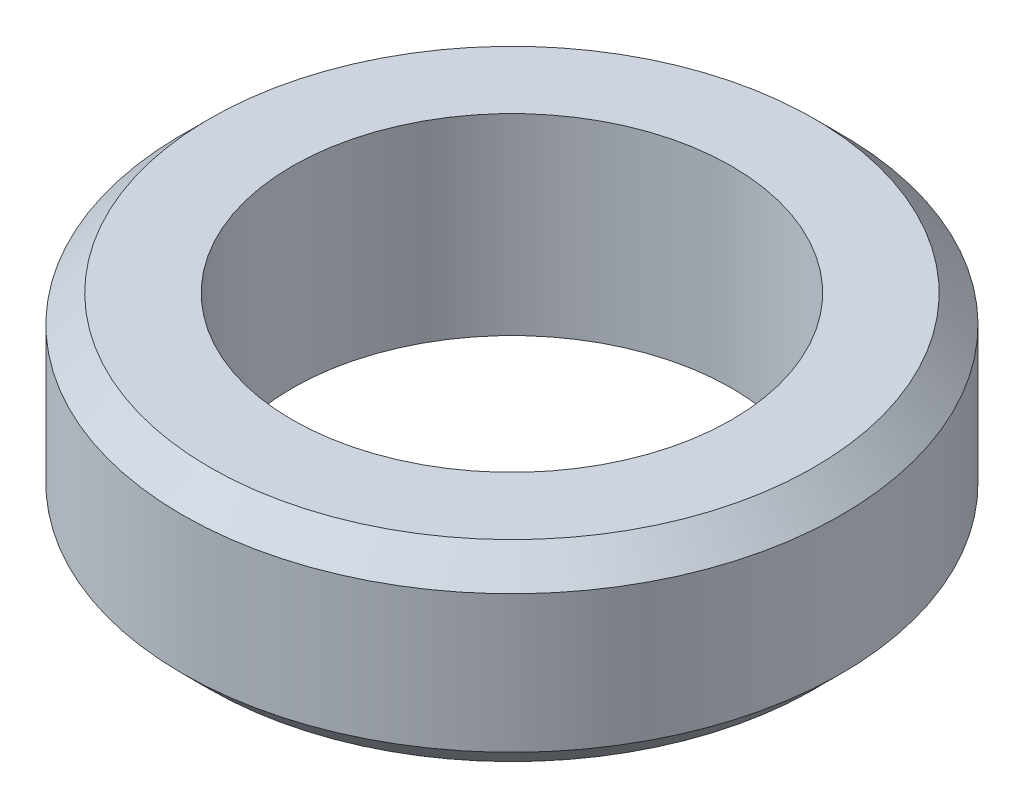
from build123d import *

# Parameters (mm, degrees)
SKETCH1_R           = 6
SKETCH1_R_2         = 4
BOSS_EXTRUDE1_DEPTH = 3.5
CHAMFER1_SIZE       = 0.5


with BuildPart() as part:
    # Sketch1 → Boss-Extrude1 (new body)
    with BuildSketch(Plane(origin=(0, 0, 0), x_dir=(1, 0, 0), z_dir=(0, 1, 0))):
        with Locations(Location((0, 0, 0), (0, 0, 270))):
            Circle(SKETCH1_R)
        with Locations(Location((0, 0, 0), (0, 0, 270))):
            Circle(SKETCH1_R_2, mode=Mode.SUBTRACT)
    extrude(amount=BOSS_EXTRUDE1_DEPTH)

    # Chamfer1
    chamfer1_edges = [part.edges().sort_by_distance(p)[0] for p in [
        (0, 0, -6),
        (0, 3.5, -6),
    ]]
    chamfer(chamfer1_edges, length=CHAMFER1_SIZE)


solid = part.part
